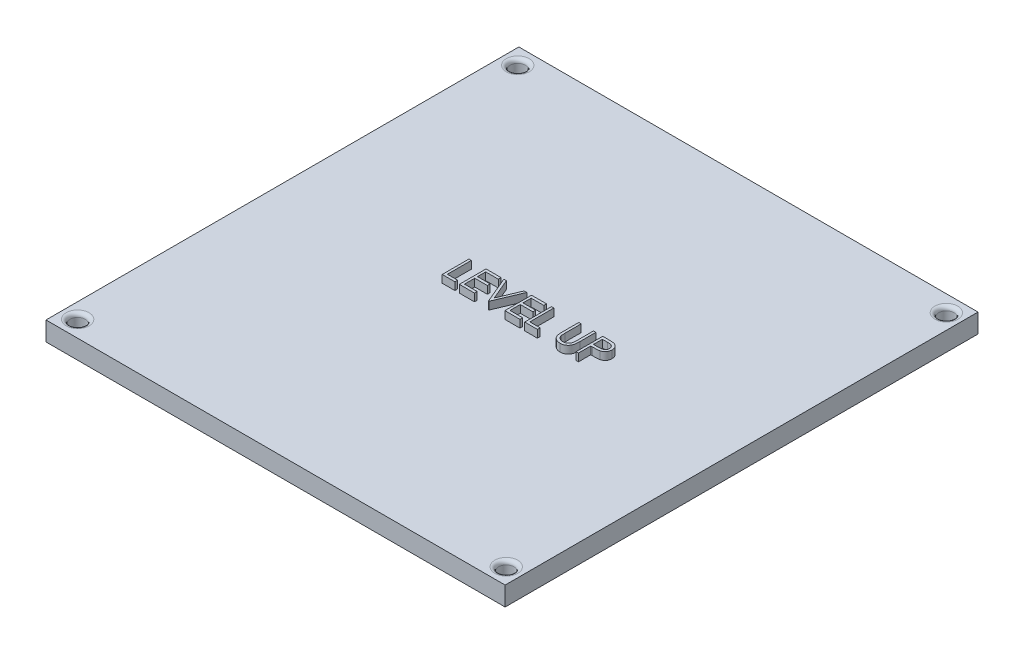
from build123d import *

# Parameters (mm, degrees)
SKETCH1_W           = 60.2
SKETCH1_H           = 62
BOSS_EXTRUDE1_DEPTH = 2.5
SKETCH2_R           = 1
CUT_EXTRUDE2_DEPTH  = 2.5
FILLET3_R           = 0.5
BOSS_EXTRUDE2_DEPTH = 1


with BuildPart() as part:
    # Sketch1 → Boss-Extrude1 (new body)
    with BuildSketch(Plane(origin=(0, 0, 0), x_dir=(1, 0, 0), z_dir=(0, 1, 0))):
        Rectangle(SKETCH1_W, SKETCH1_H)
    extrude(amount=BOSS_EXTRUDE1_DEPTH)

    # Sketch2 → Cut-Extrude2 (cut)
    with BuildSketch(Plane(origin=(0, 2.5, 0), x_dir=(1, 0, 0), z_dir=(0, 1, 0))):
        with Locations(Location((-28.1, 28.85, 0), (0, 0, 270))):
            Circle(SKETCH2_R)
        with Locations(Location((28.1, 28.85, 0), (0, 0, 90))):
            Circle(SKETCH2_R)
        with Locations(Location((28.1, -28.85, 0), (0, 0, 270))):
            Circle(SKETCH2_R)
        with Locations(Location((-28.1, -28.85, 0), (0, 0, 90))):
            Circle(SKETCH2_R)
    extrude(amount=-CUT_EXTRUDE2_DEPTH, mode=Mode.SUBTRACT)

    # Fillet3
    fillet3_edges = [part.edges().sort_by_distance(p)[0] for p in [
        (-28.1, 2.5, 29.85),
        (28.1, 2.5, 27.85),
        (28.1, 2.5, -27.85),
        (-28.1, 2.5, -29.85),
    ]]
    fillet(fillet3_edges, radius=FILLET3_R)

    # Sketch3 → Boss-Extrude2 (add)
    # profile 1 of 7: a face of its own
    with BuildSketch(Plane(origin=(0, 2.5, 0), x_dir=(1, 0, 0), z_dir=(0, 1, 0))):
        Polygon((-8.291823152, 2.643084206), (-7.977720588, 2.643084206), (-7.977720588, -0.497941435), (-6.631566742, -0.497941435), (-6.631566742, -0.856915794), (-8.291823152, -0.856915794), align=None)
    # profile 2 of 7: a face of its own
    with BuildSketch(Plane(origin=(0, 2.5, 0), x_dir=(1, 0, 0), z_dir=(0, 1, 0))):
        Polygon((-6.048233409, 2.643084206), (-4.073874434, 2.643084206), (-4.073874434, 2.284109847), (-5.734130844, 2.284109847), (-5.734130844, 1.20718677), (-4.073874434, 1.20718677), (-4.073874434, 0.848212411), (-5.734130844, 0.848212411), (-5.734130844, -0.497941435), (-4.073874434, -0.497941435), (-4.073874434, -0.856915794), (-6.048233409, -0.856915794), align=None)
    # profile 3 of 7: a face of its own
    with BuildSketch(Plane(origin=(0, 2.5, 0), x_dir=(1, 0, 0), z_dir=(0, 1, 0))):
        Polygon((-3.714900075, 2.643084206), (-3.378361614, 2.643084206), (-2.211694947, -0.115128935), (-1.04502828, 2.643084206), (-0.708489819, 2.643084206), (-2.18925905, -0.856915794), (-2.234130844, -0.856915794), align=None)
    # profile 4 of 7: a face of its own
    with BuildSketch(Plane(origin=(0, 2.5, 0), x_dir=(1, 0, 0), z_dir=(0, 1, 0))):
        Polygon((-0.080284691, 2.643084206), (1.894074284, 2.643084206), (1.894074284, 2.284109847), (0.233817873, 2.284109847), (0.233817873, 1.20718677), (1.894074284, 1.20718677), (1.894074284, 0.848212411), (0.233817873, 0.848212411), (0.233817873, -0.497941435), (1.894074284, -0.497941435), (1.894074284, -0.856915794), (-0.080284691, -0.856915794), align=None)
    # profile 5 of 7: a face of its own
    with BuildSketch(Plane(origin=(0, 2.5, 0), x_dir=(1, 0, 0), z_dir=(0, 1, 0))):
        Polygon((2.522279412, 2.643084206), (2.836381976, 2.643084206), (2.836381976, -0.497941435), (4.182535822, -0.497941435), (4.182535822, -0.856915794), (2.522279412, -0.856915794), align=None)
    # profile 6 of 7: a face of its own
    with BuildSketch(Plane(origin=(0, 2.5, 0), x_dir=(1, 0, 0), z_dir=(0, 1, 0))):
        with BuildLine():
            Line((6.112023002, 2.643084206), (6.426125566, 2.643084206))
            Line((6.426125566, 2.643084206), (6.426125566, 0.546028917))
            add(Edge.make_bspline(
                [(6.426125566, 0.546028917), (6.426078822, 0.516348182), (6.425990117, 0.460023871), (6.426582631, 0.37985557), (6.428241999, 0.308583111), (6.429288159, 0.245931763), (6.431615492, 0.192189016), (6.433513539, 0.147063705), (6.435954096, 0.110769503), (6.438887214, 0.089588577), (6.440148002, 0.080484046)],
                knots=[0, 0, 0, 0, 1.528628734, 2.90083645, 4.128790002, 5.200304208, 6.127813768, 6.898992206, 7.526736466, 8, 8, 8, 8], degree=3))
            add(Edge.make_bspline(
                [(6.440148002, 0.080484046), (6.445325461, 0.047637282), (6.455388647, -0.016205447), (6.481035025, -0.107113729), (6.516852526, -0.189045187), (6.559295568, -0.264556478), (6.61522818, -0.331545838), (6.682231715, -0.393257491), (6.763409484, -0.447229296), (6.853670089, -0.496580107), (6.950955327, -0.53624519), (7.050366593, -0.566238554), (7.150409572, -0.584517454), (7.217385737, -0.586633993), (7.250644797, -0.587685025)],
                knots=[0, 0, 0, 0, 1.035780045, 2.013197591, 2.933192213, 3.817615948, 4.702609284, 5.640816605, 6.646850145, 7.73207398, 8.84249596, 9.914020372, 10.964143139, 12, 12, 12, 12], degree=3))
            add(Edge.make_bspline(
                [(7.250644797, -0.587685025), (7.279198537, -0.586611175), (7.336141099, -0.584469676), (7.42074753, -0.571208245), (7.503147638, -0.54730768), (7.583748318, -0.516467921), (7.659299303, -0.47572033), (7.729842745, -0.428649491), (7.792806679, -0.373438615), (7.850264677, -0.31233827), (7.900299612, -0.24339847), (7.943670754, -0.168120332), (7.979196684, -0.085370985), (7.996740209, -0.027216563), (8.00575297, 0.002659526)],
                knots=[0, 0, 0, 0, 0.994687771, 1.983630487, 2.973142513, 3.978332533, 4.983357753, 5.956394766, 6.925816176, 7.893390482, 8.871859704, 9.88551698, 10.913711441, 12, 12, 12, 12], degree=3))
            add(Edge.make_bspline(
                [(8.00575297, 0.002659526), (8.008753095, 0.015008101), (8.015438583, 0.042525701), (8.021685628, 0.089046991), (8.028192154, 0.143936355), (8.032706724, 0.207588168), (8.037107944, 0.279789141), (8.039741017, 0.360915398), (8.04095805, 0.450672359), (8.04132073, 0.513309521), (8.041510181, 0.546028917)],
                knots=[0, 0, 0, 0, 0.558680831, 1.244966039, 2.062412453, 2.990489873, 4.051219941, 5.244515665, 6.560634259, 8, 8, 8, 8], degree=3))
            Line((8.041510181, 0.546028917), (8.041510181, 2.643084206))
            Line((8.041510181, 2.643084206), (8.355612745, 2.643084206))
            Line((8.355612745, 2.643084206), (8.355612745, 0.529201994))
            add(Edge.make_bspline(
                [(8.355612745, 0.529201994), (8.355358625, 0.491103615), (8.354862694, 0.416752312), (8.350562117, 0.307800953), (8.343705117, 0.204447972), (8.334017029, 0.106679476), (8.321180026, 0.014845316), (8.306904806, -0.071859452), (8.288725272, -0.152812445), (8.267491871, -0.228644862), (8.243218323, -0.300830376), (8.211777175, -0.36933899), (8.176352675, -0.43625339), (8.134338022, -0.500561499), (8.087126639, -0.562548052), (8.033674959, -0.621837127), (7.975750798, -0.679376173), (7.912391238, -0.733689239), (7.844640713, -0.783497916), (7.772700755, -0.827295687), (7.697123986, -0.864319305), (7.618106859, -0.894795229), (7.535615657, -0.917709828), (7.449648297, -0.934784984), (7.360009103, -0.944487282), (7.299044447, -0.945929212), (7.268172841, -0.946659384)],
                knots=[0, 0, 0, 0, 1.316592851, 2.569410997, 3.76748051, 4.895814652, 5.963796859, 6.97159953, 7.931736103, 8.829262218, 9.692595152, 10.560224239, 11.431080259, 12.30701507, 13.211635791, 14.121146779, 15.063487852, 16.031507147, 17.00238618, 17.966455255, 18.938106653, 19.907068911, 20.888905087, 21.893141452, 22.933117798, 24, 24, 24, 24], degree=3))
            add(Edge.make_bspline(
                [(7.268172841, -0.946659384), (7.234503739, -0.945874619), (7.16844508, -0.944334912), (7.071107013, -0.935512162), (6.977792816, -0.918893768), (6.887516939, -0.897733824), (6.801508442, -0.868550087), (6.718614998, -0.834451962), (6.640256317, -0.792574701), (6.565161188, -0.745981308), (6.495336432, -0.69355667), (6.431239029, -0.636416496), (6.372763158, -0.575476119), (6.320894462, -0.510075753), (6.274773577, -0.440724046), (6.235043364, -0.367224806), (6.20093012, -0.28960649), (6.183323553, -0.23565329), (6.174422841, -0.208378134)],
                knots=[0, 0, 0, 0, 1.13879206, 2.234305948, 3.301075583, 4.341971843, 5.366689343, 6.369221514, 7.369726634, 8.367512178, 9.355451585, 10.318319045, 11.268648973, 12.207971039, 13.137398894, 14.081662264, 15.030215811, 16, 16, 16, 16], degree=3))
            add(Edge.make_bspline(
                [(6.174422841, -0.208378134), (6.169245683, -0.189745559), (6.158016312, -0.149331091), (6.145991014, -0.082444602), (6.135881933, -0.005429684), (6.126376374, 0.081718934), (6.120767416, 0.179068801), (6.115849978, 0.286577716), (6.111988359, 0.404375678), (6.112011131, 0.486430194), (6.112023002, 0.529201994)],
                knots=[0, 0, 0, 0, 0.625038921, 1.35572334, 2.194682327, 3.136881307, 4.189498639, 5.346923369, 6.617055217, 8, 8, 8, 8], degree=3))
            Line((6.112023002, 0.529201994), (6.112023002, 2.643084206))
        make_face()
    # profile 7 of 7: a face of its own
    with BuildSketch(Plane(origin=(0, 2.5, 0), x_dir=(1, 0, 0), z_dir=(0, 1, 0))):
        with BuildLine():
            Line((9.253048643, 2.643084206), (9.93944688, 2.643084206))
            add(Edge.make_bspline(
                [(9.93944688, 2.643084206), (9.986657786, 2.64303231), (10.077115979, 2.642932874), (10.206831035, 2.639918128), (10.324640766, 2.635891436), (10.430291147, 2.630309543), (10.524107245, 2.623712953), (10.605664545, 2.614460913), (10.675604101, 2.604800618), (10.717510551, 2.594979211), (10.736622361, 2.590500071)],
                knots=[0, 0, 0, 0, 1.415646017, 2.712440637, 3.8905458, 4.950247383, 5.884950622, 6.709939814, 7.411656543, 8, 8, 8, 8], degree=3))
            add(Edge.make_bspline(
                [(10.736622361, 2.590500071), (10.760815894, 2.583878121), (10.808632872, 2.57079026), (10.877533915, 2.544576536), (10.94308776, 2.513494371), (11.005519319, 2.478070431), (11.064061402, 2.436784867), (11.119587443, 2.391311249), (11.171607423, 2.340599681), (11.219828815, 2.285218941), (11.264113613, 2.226098731), (11.302243295, 2.162356501), (11.334170522, 2.095065198), (11.361553794, 2.024271626), (11.381262248, 1.949381303), (11.396109148, 1.870914591), (11.405532776, 1.7888799), (11.406435337, 1.732820033), (11.406894797, 1.704282122)],
                knots=[0, 0, 0, 0, 0.999701418, 1.975846123, 2.934577507, 3.890451536, 4.834027766, 5.787354733, 6.749476667, 7.726910423, 8.712836071, 9.690891519, 10.682875813, 11.679750201, 12.712814741, 13.765529915, 14.8625177, 16, 16, 16, 16], degree=3))
            add(Edge.make_bspline(
                [(11.406894797, 1.704282122), (11.406473372, 1.675504346), (11.405648826, 1.619198682), (11.395752541, 1.536825894), (11.382422349, 1.458107503), (11.361925297, 1.383218053), (11.335079624, 1.312602282), (11.303587571, 1.24518105), (11.26560404, 1.182101379), (11.221959211, 1.123134261), (11.173407616, 1.068224349), (11.120154678, 1.017769554), (11.062415386, 0.972065216), (11.000373237, 0.931008872), (10.933423389, 0.895552593), (10.862581235, 0.863795288), (10.787231019, 0.837124227), (10.735088505, 0.823094166), (10.708577489, 0.815960808)],
                knots=[0, 0, 0, 0, 1.121902311, 2.195077645, 3.232258892, 4.234102512, 5.217864754, 6.176164875, 7.132989551, 8.084763148, 9.034132444, 9.988522005, 10.94243251, 11.903244335, 12.886203696, 13.894208494, 14.929344452, 16, 16, 16, 16], degree=3))
            add(Edge.make_bspline(
                [(10.708577489, 0.815960808), (10.686650155, 0.811297827), (10.638595128, 0.801078633), (10.559452405, 0.789670176), (10.467307019, 0.779932576), (10.36228474, 0.772631438), (10.244479835, 0.76638107), (10.113828577, 0.761412976), (9.9700745, 0.758683122), (9.869803256, 0.758542329), (9.817451688, 0.758468821)],
                knots=[0, 0, 0, 0, 0.601384939, 1.31797006, 2.144135048, 3.087295005, 4.142315834, 5.309527816, 6.595305764, 8, 8, 8, 8], degree=3))
            Line((9.817451688, 0.758468821), (9.567151207, 0.758468821))
            Line((9.567151207, 0.758468821), (9.567151207, -0.856915794))
            Line((9.567151207, -0.856915794), (9.253048643, -0.856915794))
            Line((9.253048643, -0.856915794), (9.253048643, 2.643084206))
        make_face()
        with BuildLine():
            Line((9.567151207, 2.284109847), (9.567151207, 1.11744318))
            Line((9.567151207, 1.11744318), (10.179931656, 1.10973084))
            add(Edge.make_bspline(
                [(10.179931656, 1.10973084), (10.209851581, 1.109715377), (10.267611381, 1.109685525), (10.351047605, 1.113670748), (10.428456892, 1.118271281), (10.499601467, 1.125007204), (10.564513402, 1.134528462), (10.623300931, 1.1441402), (10.675508213, 1.158045562), (10.736607415, 1.176768631), (10.804690763, 1.208701247), (10.878758311, 1.255051137), (10.941528898, 1.314131845), (10.995847194, 1.380559677), (11.038953072, 1.454458806), (11.070509065, 1.533527743), (11.089050222, 1.616955592), (11.091536416, 1.674043731), (11.092792232, 1.702879879)],
                knots=[0, 0, 0, 0, 1.160613943, 2.240541288, 3.23993089, 4.169200891, 5.011653406, 5.7853311, 6.478053781, 7.106038997, 8.262395093, 9.384106736, 10.481365981, 11.59014053, 12.70357646, 13.786202915, 14.881775077, 16, 16, 16, 16], degree=3))
            add(Edge.make_bspline(
                [(11.092792232, 1.702879879), (11.091529586, 1.731018392), (11.089019601, 1.786954274), (11.070363738, 1.868933035), (11.039014424, 1.947168739), (10.995557829, 2.020141825), (10.9428167, 2.086330629), (10.881517356, 2.143827756), (10.811804095, 2.190049459), (10.746955864, 2.21988274), (10.689354678, 2.238098016), (10.639322718, 2.250842856), (10.582832044, 2.261018462), (10.519864264, 2.269257965), (10.45090743, 2.276311426), (10.375369115, 2.281097404), (10.293535472, 2.28389886), (10.236724901, 2.284037815), (10.207275406, 2.284109847)],
                knots=[0, 0, 0, 0, 1.120700087, 2.227813068, 3.331159281, 4.466773991, 5.599788987, 6.693661531, 7.80175334, 8.91857717, 9.525282508, 10.207424825, 10.974604443, 11.810962634, 12.737642355, 13.736264703, 14.826523623, 16, 16, 16, 16], degree=3))
            Line((10.207275406, 2.284109847), (9.567151207, 2.284109847))
        make_face(mode=Mode.SUBTRACT)
    extrude(amount=BOSS_EXTRUDE2_DEPTH)


solid = part.part
